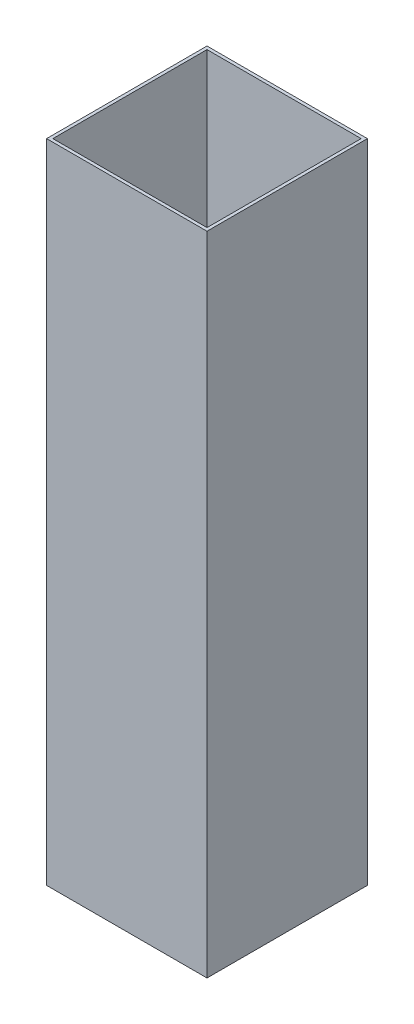
from build123d import *

# Parameters (mm, degrees)
SKETCH2_W           = 62
SKETCH2_H           = 62
BOSS_EXTRUDE1_DEPTH = 250
SHELL1_T            = -1.2


with BuildPart() as part:
    # Sketch2 → Boss-Extrude1 (new body)
    with BuildSketch(Plane(origin=(0, 0, 0), x_dir=(1, 0, 0), z_dir=(0, 1, 0))):
        with Locations((-7.035460993, -10.003546099)):
            Rectangle(SKETCH2_W, SKETCH2_H)
    extrude(amount=BOSS_EXTRUDE1_DEPTH)

    # Shell1
    shell1_openings = [part.faces().sort_by_distance(p)[0] for p in [
        (-7.035460993, 250, 10.003546099),
    ]]
    offset(amount=SHELL1_T, openings=shell1_openings, kind=Kind.INTERSECTION)


solid = part.part
